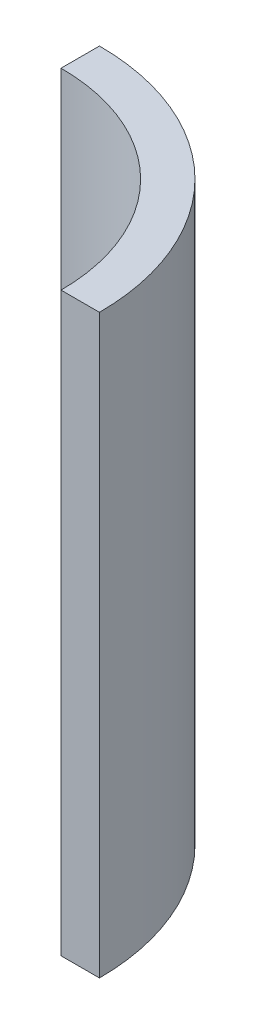
from build123d import *

# Parameters (mm, degrees)
EXTRUDE_THIN1_DEPTH = 150


with BuildPart() as part:
    # Sketch1 → Extrude-Thin1 (new body)
    with BuildSketch(Plane(origin=(0, 0, 0), x_dir=(1, 0, 0), z_dir=(0, 1, 0))):
        with BuildLine():
            ThreePointArc((50, 0), (35.355339059, 35.355339059), (0, 50))
            Line((0, 50), (0, 60))
            ThreePointArc((0, 60), (42.426406871, 42.426406871), (60, 0))
            Line((60, 0), (50, 0))
        make_face()
    extrude(amount=EXTRUDE_THIN1_DEPTH)


solid = part.part
